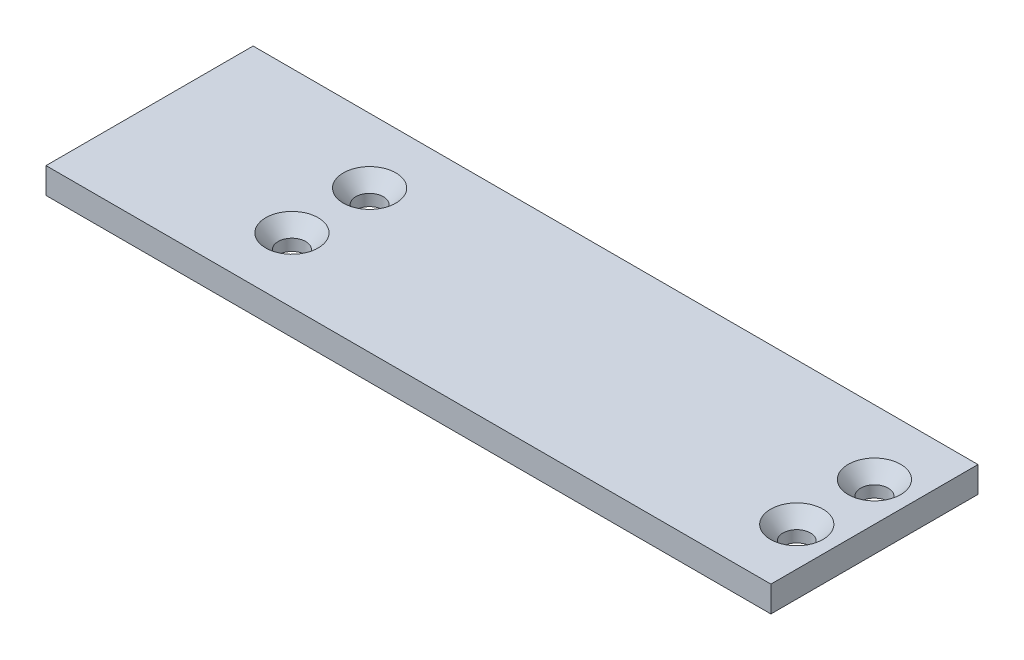
from build123d import *

# Parameters (mm, degrees)
SKETCH1_W                                        = 177.8
SKETCH1_H                                        = 50.8
BOSS_EXTRUDE1_DEPTH                              = 3.175
CSK_FOR_1_4_FLAT_HEAD_MACHINE_SCREW1_D           = 6.7564
CSK_FOR_1_4_FLAT_HEAD_MACHINE_SCREW1_DEPTH       = 19.05
CSK_FOR_1_4_FLAT_HEAD_MACHINE_SCREW1_CSINK_D     = 12.8778
CSK_FOR_1_4_FLAT_HEAD_MACHINE_SCREW1_CSINK_ANGLE = 82
CSK_FOR_1_4_FLAT_HEAD_MACHINE_SCREW1_TIP         = 2.029827343


with BuildPart() as part:
    # Sketch1 → Boss-Extrude1 (new, symmetric)
    with BuildSketch(Plane(origin=(0, 0, 0), x_dir=(1, 0, 0), z_dir=(0, 1, 0))):
        Rectangle(SKETCH1_W, SKETCH1_H)
    extrude(amount=BOSS_EXTRUDE1_DEPTH, both=True)

    # CSK for 1/4 Flat Head Machine Screw1
    with Locations(Plane(origin=(0, 3.175, 0), x_dir=(1, 0, 0), z_dir=(0, 1, 0))):
        with Locations((-44.45, 9.525), (-44.45, -9.525), (79.375, -9.525), (79.375, 9.525)):
            CounterSinkHole(CSK_FOR_1_4_FLAT_HEAD_MACHINE_SCREW1_D / 2, CSK_FOR_1_4_FLAT_HEAD_MACHINE_SCREW1_CSINK_D / 2, depth=CSK_FOR_1_4_FLAT_HEAD_MACHINE_SCREW1_DEPTH, counter_sink_angle=CSK_FOR_1_4_FLAT_HEAD_MACHINE_SCREW1_CSINK_ANGLE)
            with Locations((0, 0, -(CSK_FOR_1_4_FLAT_HEAD_MACHINE_SCREW1_DEPTH + CSK_FOR_1_4_FLAT_HEAD_MACHINE_SCREW1_TIP / 2))):  # 118° drill point
                Cone(0, CSK_FOR_1_4_FLAT_HEAD_MACHINE_SCREW1_D / 2, CSK_FOR_1_4_FLAT_HEAD_MACHINE_SCREW1_TIP, mode=Mode.SUBTRACT)


solid = part.part
